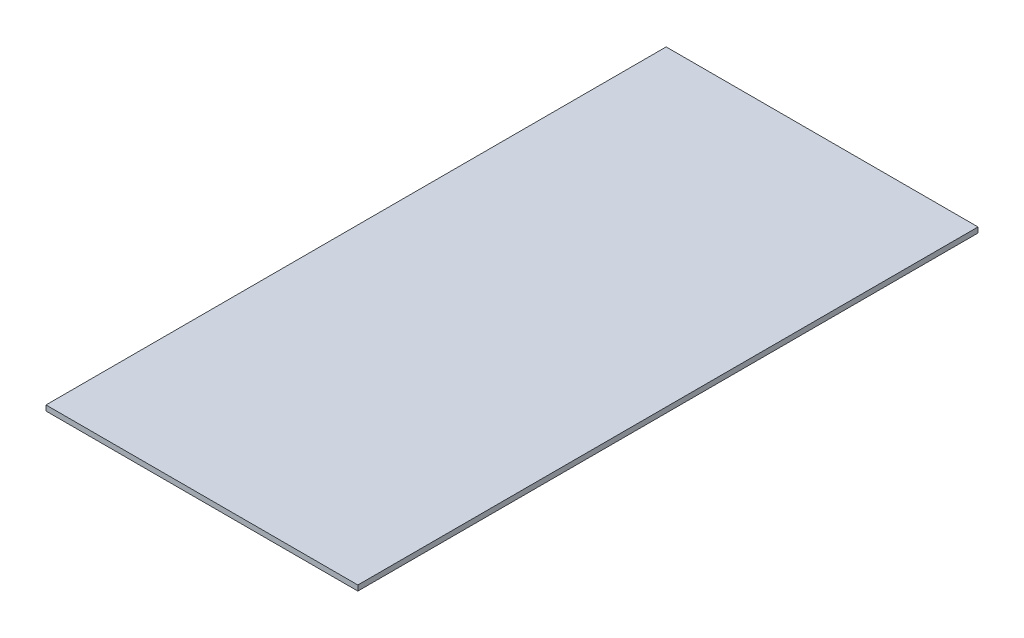
from build123d import *

# Parameters (mm, degrees)
SKETCH1_W           = 176
SKETCH1_H           = 350
BOSS_EXTRUDE1_DEPTH = 3


with BuildPart() as part:
    # Sketch1 → Boss-Extrude1 (new body)
    with BuildSketch(Plane(origin=(0, 0, 0), x_dir=(1, 0, 0), z_dir=(0, 1, 0))):
        with Locations((88, 175)):
            Rectangle(SKETCH1_W, SKETCH1_H)
    extrude(amount=BOSS_EXTRUDE1_DEPTH)


solid = part.part
